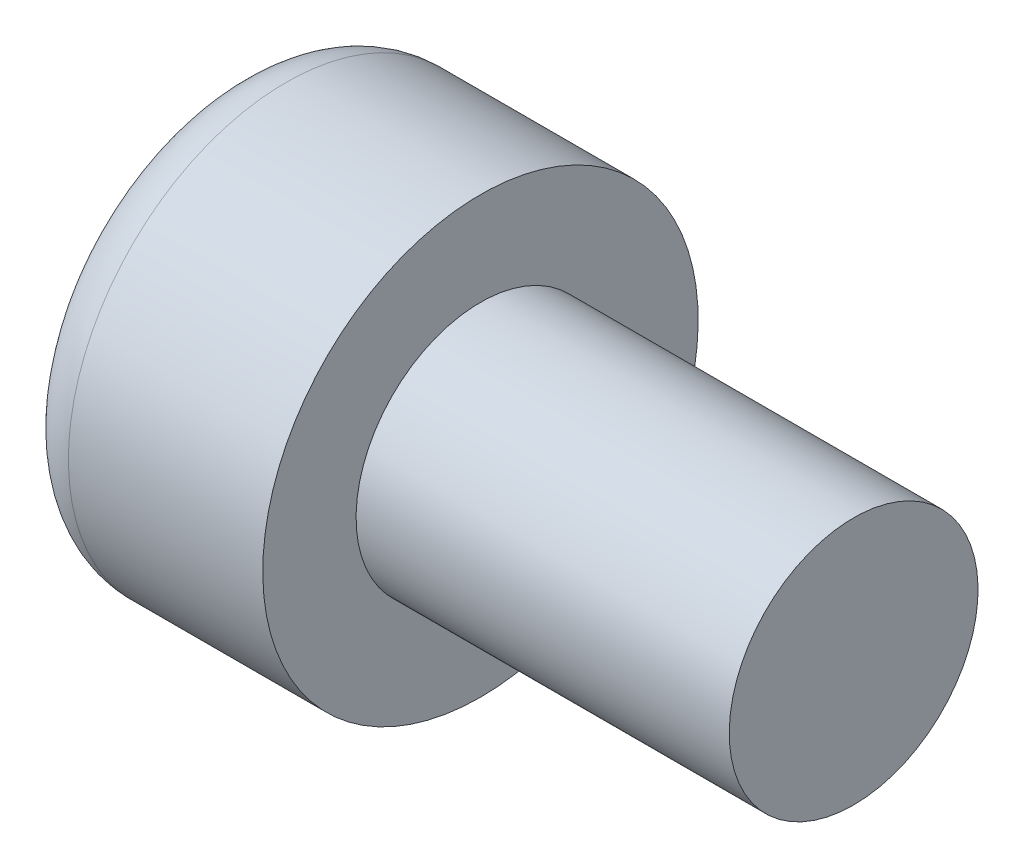
from build123d import *

# Parameters (mm, degrees)
CUT_EXTRUDE1_DEPTH = 2


with BuildPart() as part:
    # Sketch1 → Revolve1 (revolve)
    with BuildSketch(Plane.XY, mode=Mode.PRIVATE) as revolve1_sk:
        with BuildLine():
            Line((0, 0), (0, 2.625))
            ThreePointArc((0, 2.625), (0.256281566, 3.243718434), (0.875, 3.5))
            Line((0.875, 3.5), (4, 3.5))
            Line((4, 3.5), (4, 2))
            Line((4, 2), (10, 2))
            Line((10, 2), (10, 0))
            Line((10, 0), (0, 0))
        make_face()
    revolve(revolve1_sk.sketch.rotate(Axis((0, 0, 0), (1, 0, 0)), 180), axis=Axis((0, 0, 0), (1, 0, 0)))

    # Sketch2 → Cut-Extrude1 (cut)
    with BuildSketch(Plane.ZY):
        Polygon((0, 1.732050808), (-1.5, 0.866025404), (-1.5, -0.866025404), (0, -1.732050808), (1.5, -0.866025404), (1.5, 0.866025404), align=None)
    extrude(amount=-CUT_EXTRUDE1_DEPTH, mode=Mode.SUBTRACT)


solid = part.part
